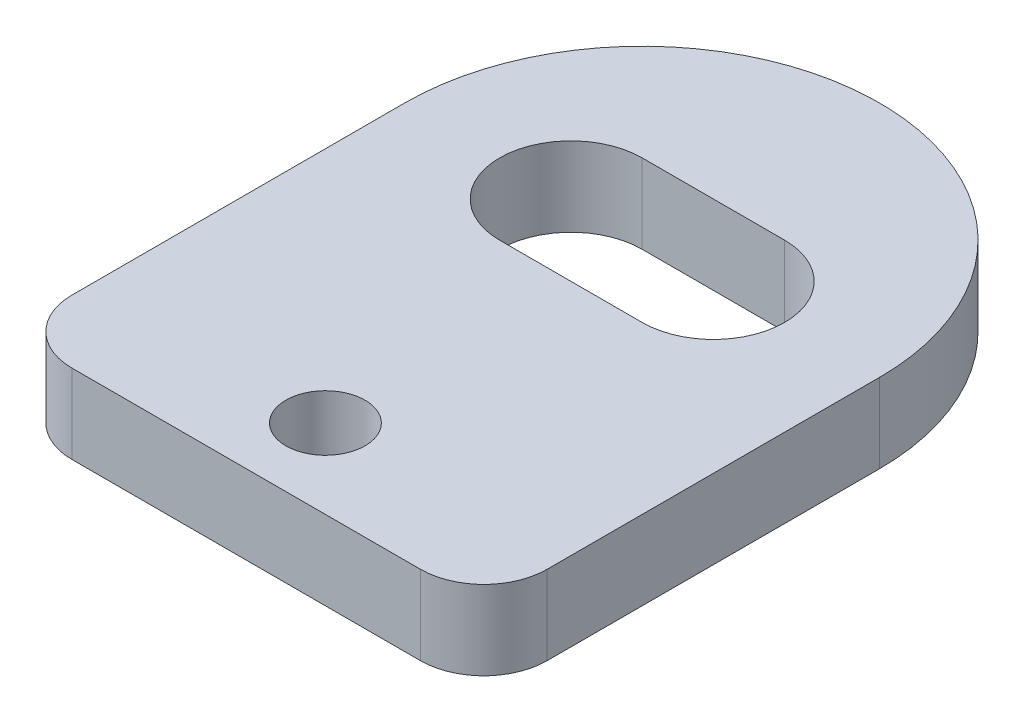
from build123d import *

# Parameters (mm, degrees)
SKETCH2_R           = 3.175
BOSS_EXTRUDE1_DEPTH = 3.175
FILLET1_R           = 5.08


with BuildPart() as part:
    # Sketch2 → Boss-Extrude1 (new, symmetric)
    with BuildSketch(Plane(origin=(0, 0, 0), x_dir=(1, 0, 0), z_dir=(0, 1, 0))):
        with BuildLine():
            Line((-19.05, 6.35), (-19.05, -25.4))
            Line((-19.05, -25.4), (19.05, -25.4))
            Line((19.05, -25.4), (19.05, 6.35))
            ThreePointArc((19.05, 6.35), (13.470384188, 19.820384175), (1.9e-08, 25.4))
            ThreePointArc((1.9e-08, 25.4), (-13.470384175, 19.820384188), (-19.05, 6.35))
        make_face()
        with Locations(Location((0, -19.05, 0), (0, 0, 270))):
            Circle(SKETCH2_R, mode=Mode.SUBTRACT)
        with BuildLine():
            ThreePointArc((-5.715, 0.635), (-11.43, 6.35), (-5.715, 12.065))
            Line((-5.715, 12.065), (5.715, 12.065))
            ThreePointArc((5.715, 12.065), (11.43, 6.35), (5.715, 0.635))
            Line((5.715, 0.635), (-5.715, 0.635))
        make_face(mode=Mode.SUBTRACT)
    extrude(amount=BOSS_EXTRUDE1_DEPTH, both=True)

    # Fillet1
    fillet1_edges = [part.edges().sort_by_distance(p)[0] for p in [
        (19.05, -1.5875, 25.4),
        (-19.05, -1.5875, 25.4),
    ]]
    fillet(fillet1_edges, radius=FILLET1_R)


solid = part.part
